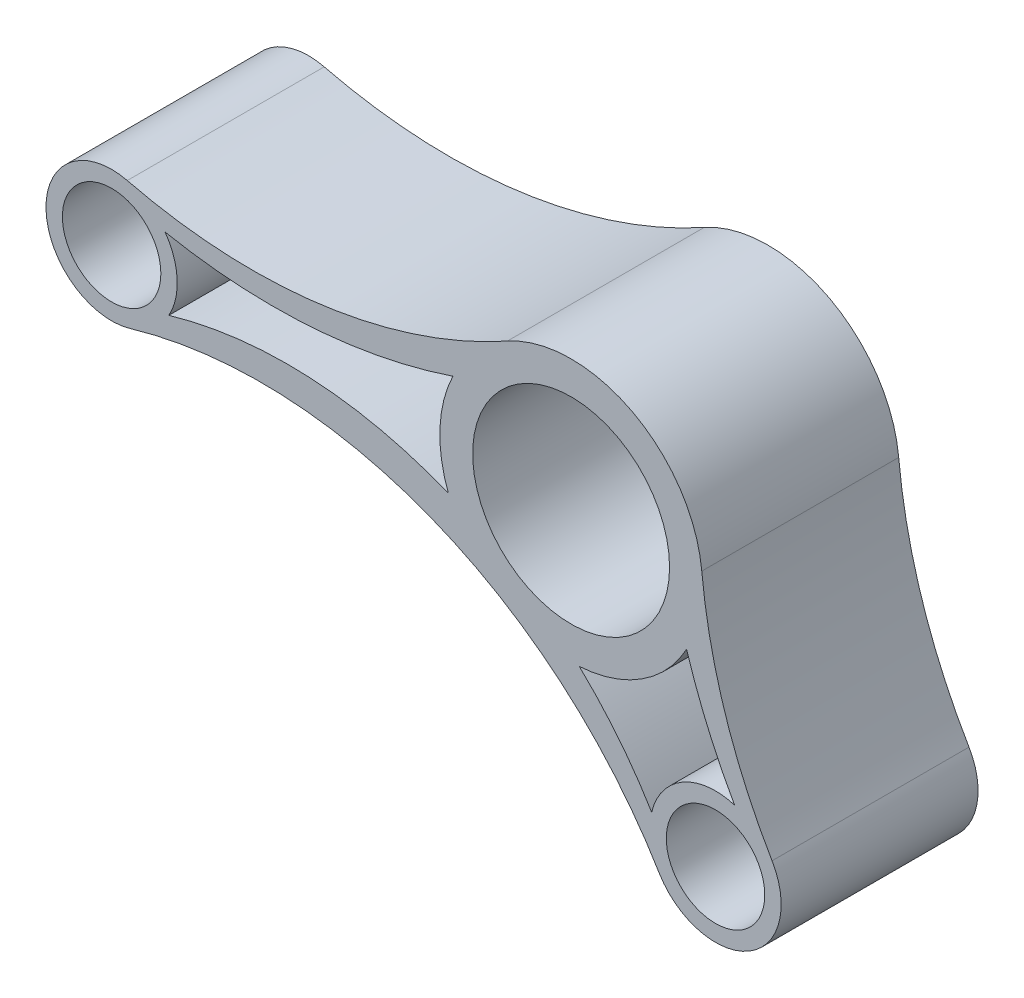
from build123d import *

# Parameters (mm, degrees)
SKETCH1_R           = 7.5
SKETCH1_R_2         = 15
BOSS_EXTRUDE1_DEPTH = 15


with BuildPart() as part:
    # Sketch1 → Boss-Extrude1 (new, symmetric)
    with BuildSketch(Plane.XY):
        with BuildLine():
            ThreePointArc((13.416465379, -41.130588018), (27.104825758, -44.598880973), (30.614150003, -30.920982406))
            ThreePointArc((30.614150003, -30.920982406), (23.463789692, -15.074619609), (19.905470006, 1.94223167))
            ThreePointArc((19.905470006, 1.94223167), (9.291872744, 17.710479974), (-9.714285714, 17.482352618))
            ThreePointArc((-9.714285714, 17.482352618), (-37.932007586, 8.122402385), (-67.619047619, 9.712418121))
            ThreePointArc((-67.619047619, 9.712418121), (-79.997392689, -0.228340587), (-67.178098245, -9.593584861))
            ThreePointArc((-67.178098245, -9.593584861), (-21.487956439, -11.580333122), (13.416465379, -41.130588018))
        make_face()
        with BuildLine():
            ThreePointArc((-18.010602512, 8.695872422), (-19.981112924, 0.868980041), (-18.697541465, -7.099432594))
            ThreePointArc((-18.697541465, -7.099432594), (-39.80648554, -2.386385888), (-61.287612025, -4.908594074))
            ThreePointArc((-61.287612025, -4.908594074), (-60.013800827, 0.525191469), (-61.850552891, 5.795387115))
            ThreePointArc((-61.850552891, 5.795387115), (-39.742227949, 4.398780735), (-18.010602512, 8.695872422))
        make_face(mode=Mode.SUBTRACT)
        with Locations((22, -36)):
            Circle(SKETCH1_R, mode=Mode.SUBTRACT)
        with BuildLine():
            ThreePointArc((17.591425152, -9.515343459), (20.794474813, -18.170038976), (24.906454326, -26.431691725))
            ThreePointArc((24.906454326, -26.431691725), (17.018206606, -27.32925986), (12.26998728, -33.692002498))
            ThreePointArc((12.26998728, -33.692002498), (7.22870194, -26.449040107), (1.246931193, -19.961091218))
            ThreePointArc((1.246931193, -19.961091218), (10.770298464, -16.852319454), (17.591425152, -9.515343459))
        make_face(mode=Mode.SUBTRACT)
        with Locations((-70, 0)):
            Circle(SKETCH1_R, mode=Mode.SUBTRACT)
        Circle(SKETCH1_R_2, mode=Mode.SUBTRACT)
    extrude(amount=BOSS_EXTRUDE1_DEPTH, both=True)


solid = part.part
